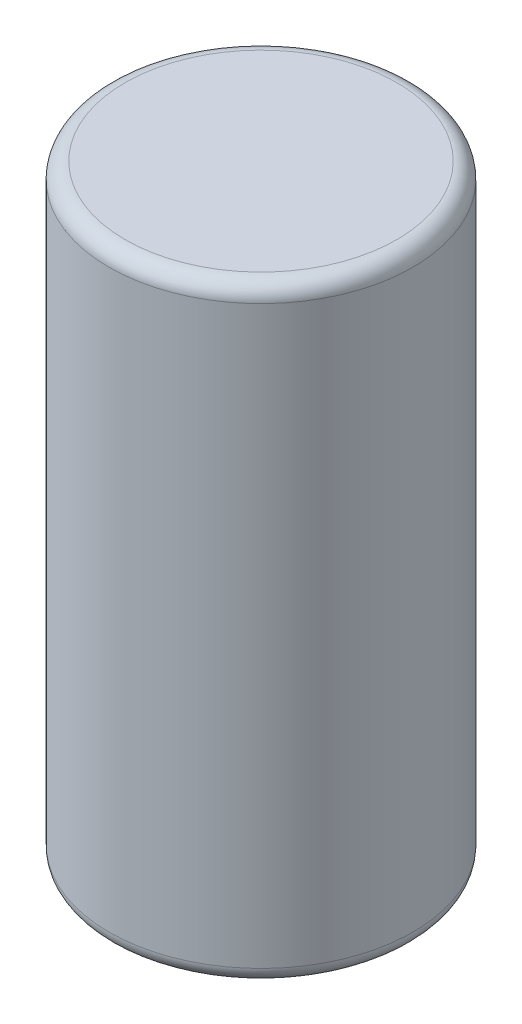
from build123d import *

# Parameters (mm, degrees)
SKETCH_1_R      = 9.5
EXTRUDE_1_DEPTH = 38
FILLET_1_R      = 1


with BuildPart() as part:
    # 草图1 → 凸台-拉伸1 (new body)
    with BuildSketch(Plane(origin=(0, 0, 0), x_dir=(1, 0, 0), z_dir=(0, 1, 0))):
        with Locations(Location((0, 0, 0), (0, 0, 270))):
            Circle(SKETCH_1_R)
    extrude(amount=EXTRUDE_1_DEPTH)

    # 圆角1
    fillet_1_edges = [part.edges().sort_by_distance(p)[0] for p in [
        (0, 0, -9.5),
        (0, 38, -9.5),
    ]]
    fillet(fillet_1_edges, radius=FILLET_1_R)


solid = part.part
